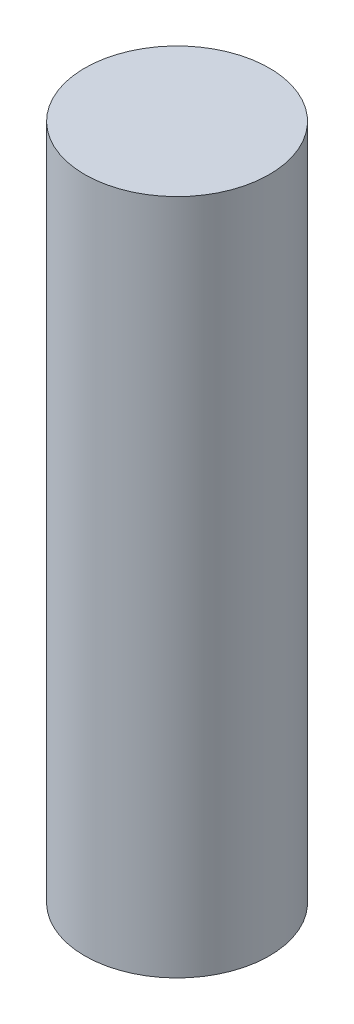
from build123d import *

# Parameters (mm, degrees)
SKETCH1_R           = 1.5
BOSS_EXTRUDE1_DEPTH = 11


with BuildPart() as part:
    # Sketch1 → Boss-Extrude1 (new body)
    with BuildSketch(Plane(origin=(0, 0, 0), x_dir=(1, 0, 0), z_dir=(0, 1, 0))):
        with Locations(Location((0, 0, 0), (0, 0, 270))):
            Circle(SKETCH1_R)
    extrude(amount=BOSS_EXTRUDE1_DEPTH)


solid = part.part
